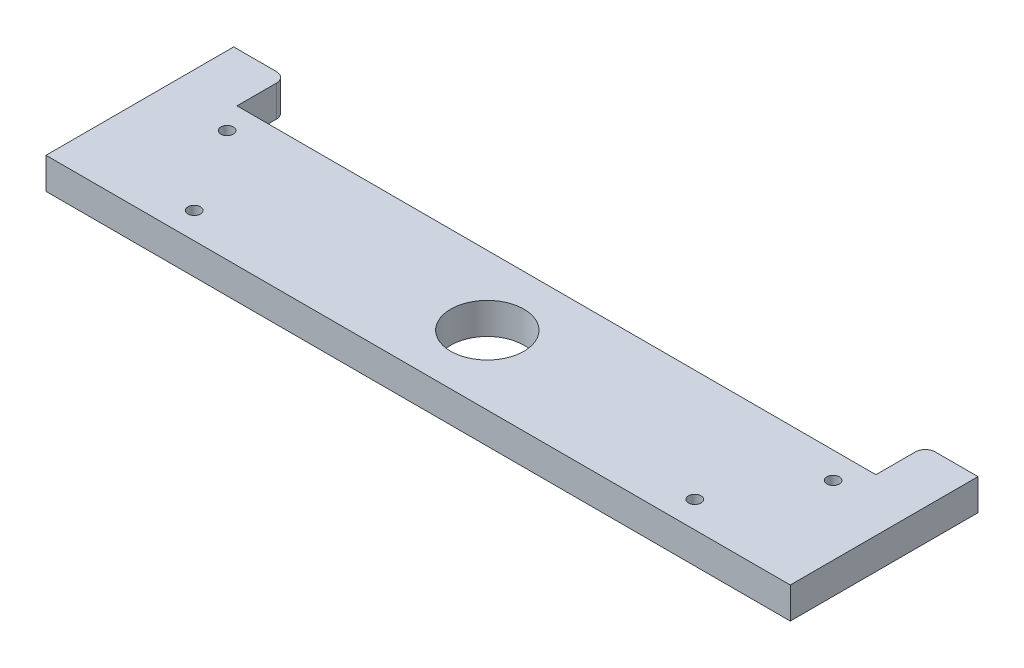
from build123d import *

# Parameters (mm, degrees)
SKETCH_1_W          = 226
SKETCH_1_H          = 42
EXTRUDE_1_DEPTH     = 9.5
SKETCH_6_W          = 16
SKETCH_6_H          = 9.5
EXTRUDE_4_DEPTH     = 15
FILLET_1_R          = 3
SKETCH_7_R          = 1.9
CUT_EXTRUDE_1_DEPTH = 234.270765421
SKETCH_9_R          = 11.1
CUT_EXTRUDE_2_DEPTH = 10
SKETCH_11_R         = 4
CUT_EXTRUDE_4_DEPTH = 4


with BuildPart() as part:
    # 草图1 → 凸台-拉伸1 (new body)
    with BuildSketch(Plane(origin=(0, 0, 0), x_dir=(1, 0, 0), z_dir=(0, 1, 0))):
        with Locations((113, 21)):
            Rectangle(SKETCH_1_W, SKETCH_1_H)
    extrude(amount=EXTRUDE_1_DEPTH)

    # 草图6 → 凸台-拉伸4 (add)
    with BuildSketch(Plane(origin=(0, 0, -42), x_dir=(-1, 0, 0), z_dir=(0, 0, -1))):
        with Locations((-8, 4.75)):
            Rectangle(SKETCH_6_W, SKETCH_6_H)
        with Locations((-218, 4.75)):
            Rectangle(SKETCH_6_W, SKETCH_6_H)
    extrude(amount=EXTRUDE_4_DEPTH)

    # 圆角1
    fillet_1_edges = [part.edges().sort_by_distance(p)[0] for p in [
        (16, 4.75, -57),
        (210, 4.75, -57),
    ]]
    fillet(fillet_1_edges, radius=FILLET_1_R)

    # 草图7 → 切除-拉伸1 (cut, through all)
    with BuildSketch(Plane(origin=(0, 9.5, 0), x_dir=(1, 0, 0), z_dir=(0, 1, 0))):
        with Locations(Location((21, 34, 0), (0, 0, 270))):
            Circle(SKETCH_7_R)
        with Locations(Location((37, 8, 0), (0, 0, 270))):
            Circle(SKETCH_7_R)
        with Locations(Location((189, 8, 0), (0, 0, 270))):
            Circle(SKETCH_7_R)
        with Locations(Location((205, 34, 0), (0, 0, 270))):
            Circle(SKETCH_7_R)
    extrude(amount=-CUT_EXTRUDE_1_DEPTH, mode=Mode.SUBTRACT)

    # 草图9 → 切除-拉伸2 (cut)
    with BuildSketch(Plane(origin=(0, 9.5, 0), x_dir=(1, 0, 0), z_dir=(0, 1, 0))):
        with Locations(Location((113, 21, 0), (0, 0, 270))):
            Circle(SKETCH_9_R)
    extrude(amount=-CUT_EXTRUDE_2_DEPTH, mode=Mode.SUBTRACT)

    # 草图11 → 切除-拉伸4 (cut)
    with BuildSketch(Plane.XZ):
        with Locations(Location((37, -8, 0), (0, 0, 270))):
            Circle(SKETCH_11_R)
        with Locations(Location((21, -34, 0), (0, 0, 270))):
            Circle(SKETCH_11_R)
        with Locations(Location((189, -8, 0), (0, 0, 270))):
            Circle(SKETCH_11_R)
        with Locations(Location((205, -34, 0), (0, 0, 270))):
            Circle(SKETCH_11_R)
    extrude(amount=-CUT_EXTRUDE_4_DEPTH, mode=Mode.SUBTRACT)


solid = part.part
